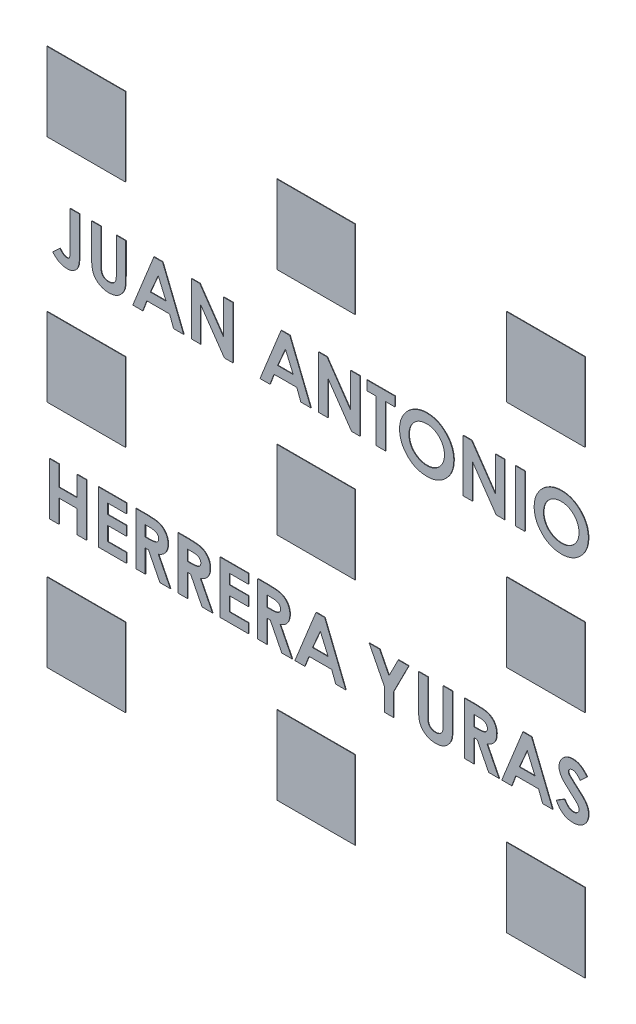
from build123d import *

# Parameters (mm, degrees)
SKETCH1_W              = 30
SKETCH1_H              = 30
BOSS_EXTRUDE1_DEPTH    = 0.2
BOSS_EXTRUDE1_2_DEPTH  = 0.2
BOSS_EXTRUDE1_3_DEPTH  = 0.2
BOSS_EXTRUDE1_4_DEPTH  = 0.2
BOSS_EXTRUDE1_5_DEPTH  = 0.2
BOSS_EXTRUDE1_6_DEPTH  = 0.2
BOSS_EXTRUDE1_7_DEPTH  = 0.2
BOSS_EXTRUDE1_8_DEPTH  = 0.2
BOSS_EXTRUDE1_9_DEPTH  = 0.2
BOSS_EXTRUDE1_10_DEPTH = 0.2
BOSS_EXTRUDE1_11_DEPTH = 0.2
BOSS_EXTRUDE1_12_DEPTH = 0.2
BOSS_EXTRUDE1_13_DEPTH = 0.2
BOSS_EXTRUDE1_14_DEPTH = 0.2
BOSS_EXTRUDE1_15_DEPTH = 0.2
BOSS_EXTRUDE1_16_DEPTH = 0.2
BOSS_EXTRUDE1_17_DEPTH = 0.2
BOSS_EXTRUDE1_18_DEPTH = 0.2
SKETCH1_W_2            = 3.589743589
SKETCH1_H_2            = 20
BOSS_EXTRUDE1_19_DEPTH = 0.2
BOSS_EXTRUDE1_20_DEPTH = 0.2
BOSS_EXTRUDE1_21_DEPTH = 0.2
BOSS_EXTRUDE1_22_DEPTH = 0.2
BOSS_EXTRUDE1_23_DEPTH = 0.2
BOSS_EXTRUDE1_24_DEPTH = 0.2
BOSS_EXTRUDE1_25_DEPTH = 0.2
BOSS_EXTRUDE1_26_DEPTH = 0.2
BOSS_EXTRUDE1_27_DEPTH = 0.2
BOSS_EXTRUDE1_28_DEPTH = 0.2
BOSS_EXTRUDE1_29_DEPTH = 0.2
BOSS_EXTRUDE1_30_DEPTH = 0.2
BOSS_EXTRUDE1_31_DEPTH = 0.2
BOSS_EXTRUDE1_32_DEPTH = 0.2


with BuildPart() as part:
    # Sketch1 → Boss-Extrude1 (new body)
    with BuildSketch(Plane.XY):
        with Locations((-88, -88)):
            Rectangle(SKETCH1_W, SKETCH1_H)
    extrude(amount=BOSS_EXTRUDE1_DEPTH)


with BuildPart() as body_2:
    # Sketch1 → Boss-Extrude1 2 (new body)
    with BuildSketch(Plane.XY):
        with Locations((0, -88)):
            Rectangle(SKETCH1_W, SKETCH1_H)
    extrude(amount=BOSS_EXTRUDE1_2_DEPTH)


with BuildPart() as body_3:
    # Sketch1 → Boss-Extrude1 3 (new body)
    with BuildSketch(Plane.XY):
        with Locations((88, -88)):
            Rectangle(SKETCH1_W, SKETCH1_H)
    extrude(amount=BOSS_EXTRUDE1_3_DEPTH)


with BuildPart() as body_4:
    # Sketch1 → Boss-Extrude1 4 (new body)
    with BuildSketch(Plane.XY):
        Rectangle(SKETCH1_W, SKETCH1_H)
    extrude(amount=BOSS_EXTRUDE1_4_DEPTH)


with BuildPart() as body_5:
    # Sketch1 → Boss-Extrude1 5 (new body)
    with BuildSketch(Plane.XY):
        with Locations((88, 0)):
            Rectangle(SKETCH1_W, SKETCH1_H)
    extrude(amount=BOSS_EXTRUDE1_5_DEPTH)


with BuildPart() as body_6:
    # Sketch1 → Boss-Extrude1 6 (new body)
    with BuildSketch(Plane.XY):
        with Locations((0, 88)):
            Rectangle(SKETCH1_W, SKETCH1_H)
    extrude(amount=BOSS_EXTRUDE1_6_DEPTH)


with BuildPart() as body_7:
    # Sketch1 → Boss-Extrude1 7 (new body)
    with BuildSketch(Plane.XY):
        with Locations((88, 88)):
            Rectangle(SKETCH1_W, SKETCH1_H)
    extrude(amount=BOSS_EXTRUDE1_7_DEPTH)


with BuildPart() as body_8:
    # Sketch1 → Boss-Extrude1 8 (new body)
    with BuildSketch(Plane.XY):
        with Locations((-88, 0)):
            Rectangle(SKETCH1_W, SKETCH1_H)
    extrude(amount=BOSS_EXTRUDE1_8_DEPTH)


with BuildPart() as body_9:
    # Sketch1 → Boss-Extrude1 9 (new body)
    with BuildSketch(Plane.XY):
        with Locations((-88, 88)):
            Rectangle(SKETCH1_W, SKETCH1_H)
    extrude(amount=BOSS_EXTRUDE1_9_DEPTH)


with BuildPart() as body_10:
    # Sketch1 → Boss-Extrude1 10 (new body)
    with BuildSketch(Plane.XY):
        with BuildLine():
            Line((-94.130265897, 53.597343664), (-90.540522307, 53.597343664))
            Line((-90.540522307, 53.597343664), (-90.540522307, 40.320100074))
            add(Edge.make_bspline(
                [(-90.540522307, 40.320100074), (-90.541838415, 40.066336043), (-90.544374295, 39.577382858), (-90.56976295, 38.873470764), (-90.604092888, 38.228088426), (-90.653531311, 37.642269956), (-90.726960905, 37.116043681), (-90.810060909, 36.648096716), (-90.901743281, 36.236522307), (-91.056617304, 35.775906513), (-91.297054737, 35.265826918), (-91.659881687, 34.714868468), (-92.111717373, 34.236179458), (-92.632082835, 33.820382724), (-93.225362538, 33.491150364), (-93.877888712, 33.253180333), (-94.587575385, 33.111015388), (-95.079122647, 33.093526872), (-95.332188974, 33.084523151)],
                knots=[0, 0, 0, 0, 1.22248561, 2.355488409, 3.392943897, 4.335991845, 5.186735882, 5.951517034, 6.625683685, 7.215700098, 8.28923535, 9.333114649, 10.380102123, 11.447198135, 12.530158036, 13.633358744, 14.781567393, 16, 16, 16, 16], degree=3))
            add(Edge.make_bspline(
                [(-95.332188974, 33.084523151), (-95.595861059, 33.092686135), (-96.115925373, 33.108786728), (-96.878653251, 33.245922433), (-97.611730086, 33.465792231), (-98.311363327, 33.78369757), (-98.98713816, 34.18191696), (-99.626789892, 34.675869353), (-100.243673572, 35.250235119), (-100.609365983, 35.690988993), (-100.796932564, 35.917055202)],
                knots=[0, 0, 0, 0, 0.990984786, 1.954608977, 2.90473533, 3.862451285, 4.837525908, 5.848096122, 6.896271184, 8, 8, 8, 8], degree=3))
            Line((-100.796932564, 35.917055202), (-98.08058641, 38.429074433))
            add(Edge.make_bspline(
                [(-98.08058641, 38.429074433), (-97.938361591, 38.268258328), (-97.67222072, 37.967328161), (-97.271154272, 37.574907834), (-96.909370726, 37.259643395), (-96.568328594, 37.032240316), (-96.246495315, 36.871946531), (-95.936946421, 36.756482412), (-95.630032828, 36.691123163), (-95.42727635, 36.6798005), (-95.328182564, 36.67426674)],
                knots=[0, 0, 0, 0, 1.529509877, 2.862124173, 3.996688592, 4.944357383, 5.774364335, 6.554177287, 7.293378699, 8, 8, 8, 8], degree=3))
            add(Edge.make_bspline(
                [(-95.328182564, 36.67426674), (-95.232270809, 36.679268384), (-95.047864036, 36.6888849), (-94.79429765, 36.795784668), (-94.58052487, 36.963621797), (-94.439789489, 37.156572356), (-94.350103805, 37.353819773), (-94.2940665, 37.544489724), (-94.240887, 37.773051318), (-94.19828077, 38.039390001), (-94.166087427, 38.346979799), (-94.150041373, 38.692086587), (-94.130527312, 39.07657527), (-94.130356134, 39.345173983), (-94.130265897, 39.48676674)],
                knots=[0, 0, 0, 0, 1.003927327, 1.930222208, 2.840933547, 3.835773585, 4.407906147, 5.114514582, 5.922289074, 6.876303333, 7.950072246, 9.174518422, 10.510537432, 12, 12, 12, 12], degree=3))
            Line((-94.130265897, 39.48676674), (-94.130265897, 53.597343664))
        make_face()
    extrude(amount=BOSS_EXTRUDE1_10_DEPTH)


with BuildPart() as body_11:
    # Sketch1 → Boss-Extrude1 11 (new body)
    with BuildSketch(Plane.XY):
        with BuildLine():
            Line((-85.925137692, 53.597343664), (-82.335394102, 53.597343664))
            Line((-82.335394102, 53.597343664), (-82.335394102, 40.584523151))
            add(Edge.make_bspline(
                [(-82.335394102, 40.584523151), (-82.33519891, 40.449611872), (-82.334821897, 40.18903213), (-82.31594846, 39.815185516), (-82.298677964, 39.471542202), (-82.267517086, 39.158478405), (-82.22148179, 38.875860207), (-82.176904601, 38.621872169), (-82.116573784, 38.40106166), (-82.025906212, 38.14972149), (-81.886217247, 37.867327082), (-81.657973228, 37.573009151), (-81.394599156, 37.304401321), (-81.078930162, 37.08082234), (-80.724146128, 36.899967096), (-80.332196437, 36.765973376), (-79.903633597, 36.691490658), (-79.607305902, 36.680119507), (-79.454785128, 36.67426674)],
                knots=[0, 0, 0, 0, 1.155499968, 2.231836252, 3.205919964, 4.102923608, 4.924856345, 5.658536265, 6.31071849, 6.882491295, 7.94666036, 8.992281882, 10.060072772, 11.158554251, 12.289267114, 13.461410017, 14.693379945, 16, 16, 16, 16], degree=3))
            add(Edge.make_bspline(
                [(-79.454785128, 36.67426674), (-79.292750628, 36.678995024), (-78.976810785, 36.688214378), (-78.522381617, 36.778712309), (-78.101350417, 36.922816009), (-77.722631849, 37.128488714), (-77.386602801, 37.375023497), (-77.102161252, 37.656150405), (-76.877681027, 37.972430148), (-76.731373168, 38.264222295), (-76.64922851, 38.532791557), (-76.587656997, 38.772748001), (-76.542518267, 39.055872853), (-76.501566927, 39.377744508), (-76.476958326, 39.741696935), (-76.450274311, 40.144803183), (-76.440494371, 40.589821413), (-76.438827452, 40.899695958), (-76.437958205, 41.061285971)],
                knots=[0, 0, 0, 0, 1.261321664, 2.459363699, 3.594844139, 4.716940403, 5.803436589, 6.833651888, 7.818396249, 8.814403945, 9.360733334, 10.004355033, 10.743453831, 11.592799886, 12.532235708, 13.585170094, 14.740740724, 16, 16, 16, 16], degree=3))
            Line((-76.437958205, 41.061285971), (-76.437958205, 53.597343664))
            Line((-76.437958205, 53.597343664), (-72.848214615, 53.597343664))
            Line((-72.848214615, 53.597343664), (-72.848214615, 41.66625392))
            add(Edge.make_bspline(
                [(-72.848214615, 41.66625392), (-72.848713116, 41.424530612), (-72.849671685, 40.959720265), (-72.864392417, 40.291755087), (-72.895730191, 39.681676043), (-72.922050306, 39.12930487), (-72.972988743, 38.635385703), (-73.026054645, 38.197809367), (-73.093691702, 37.818126532), (-73.194331576, 37.385903765), (-73.368006204, 36.888215079), (-73.647992474, 36.315148132), (-74.003416922, 35.754080878), (-74.423510856, 35.211185444), (-74.897835336, 34.706853082), (-75.415873571, 34.264114548), (-75.969395222, 33.88960549), (-76.564184194, 33.592483107), (-77.199734291, 33.360750046), (-77.882333805, 33.205037102), (-78.61151726, 33.099835482), (-79.115178054, 33.089729572), (-79.374656923, 33.084523151)],
                knots=[0, 0, 0, 0, 1.170808336, 2.251350247, 3.235597562, 4.129743112, 4.929140599, 5.639994148, 6.264258765, 6.79612947, 7.788252245, 8.809469599, 9.879094798, 10.999557536, 12.129761673, 13.226370002, 14.293821979, 15.358369427, 16.438775801, 17.562147481, 18.744053101, 20, 20, 20, 20], degree=3))
            add(Edge.make_bspline(
                [(-79.374656923, 33.084523151), (-79.547059845, 33.08742705), (-79.887207274, 33.093156384), (-80.38745374, 33.143674146), (-80.871040217, 33.218118332), (-81.33705805, 33.326724733), (-81.787124698, 33.467023918), (-82.221120591, 33.639722444), (-82.637432894, 33.84385702), (-83.033731981, 34.077550051), (-83.409530174, 34.330248834), (-83.752990324, 34.610376073), (-84.075931702, 34.8972153), (-84.369024664, 35.202837927), (-84.634470601, 35.524035439), (-84.871722827, 35.861535774), (-85.080428862, 36.215308954), (-85.265838594, 36.591731719), (-85.424531229, 37.00993628), (-85.558315082, 37.484798346), (-85.675191804, 38.023760904), (-85.762047687, 38.62803821), (-85.840791741, 39.295638632), (-85.890632386, 40.028301372), (-85.91670627, 40.82604745), (-85.922256203, 41.379108268), (-85.925137692, 41.66625392)],
                knots=[0, 0, 0, 0, 1.001158378, 1.975264943, 2.917723546, 3.841610987, 4.75185031, 5.653588123, 6.552117133, 7.442167995, 8.324307438, 9.179605724, 10.014504199, 10.831958861, 11.636465792, 12.43274043, 13.225645099, 14.020104002, 14.867201867, 15.819789774, 16.883317127, 18.068162734, 19.364263498, 20.787406516, 22.332041935, 24, 24, 24, 24], degree=3))
            Line((-85.925137692, 41.66625392), (-85.925137692, 53.597343664))
        make_face()
    extrude(amount=BOSS_EXTRUDE1_11_DEPTH)


with BuildPart() as body_12:
    # Sketch1 → Boss-Extrude1 12 (new body)
    with BuildSketch(Plane.XY):
        Polygon((-62.074977436, 53.597343664), (-58.745650513, 53.597343664), (-50.668727436, 33.597343664), (-54.502862051, 33.597343664), (-56.057349231, 37.699907766), (-64.771291538, 37.699907766), (-66.325778718, 33.597343664), (-70.155906923, 33.597343664), align=None)
        Polygon((-60.412317179, 48.23276033), (-63.409112051, 41.289651356), (-57.415522307, 41.289651356), align=None, mode=Mode.SUBTRACT)
    extrude(amount=BOSS_EXTRUDE1_12_DEPTH)


with BuildPart() as body_13:
    # Sketch1 → Boss-Extrude1 13 (new body)
    with BuildSketch(Plane.XY):
        Polygon((-47.720009487, 53.597343664), (-44.48683641, 53.597343664), (-35.412317179, 40.436285971), (-35.412317179, 53.597343664), (-31.822573589, 53.597343664), (-31.822573589, 33.597343664), (-35.079785128, 33.597343664), (-44.130265897, 46.718337253), (-44.130265897, 33.597343664), (-47.720009487, 33.597343664), align=None)
    extrude(amount=BOSS_EXTRUDE1_13_DEPTH)


with BuildPart() as body_14:
    # Sketch1 → Boss-Extrude1 14 (new body)
    with BuildSketch(Plane.XY):
        Polygon((-13.357028718, 53.597343664), (-10.027701795, 53.597343664), (-1.950778718, 33.597343664), (-5.784913333, 33.597343664), (-7.339400513, 37.699907766), (-16.05334282, 37.699907766), (-17.60783, 33.597343664), (-21.437958205, 33.597343664), align=None)
        Polygon((-11.694368461, 48.23276033), (-14.691163333, 41.289651356), (-8.697573589, 41.289651356), align=None, mode=Mode.SUBTRACT)
    extrude(amount=BOSS_EXTRUDE1_14_DEPTH)


with BuildPart() as body_15:
    # Sketch1 → Boss-Extrude1 15 (new body)
    with BuildSketch(Plane.XY):
        Polygon((0.997939231, 53.597343664), (4.231112308, 53.597343664), (13.305631539, 40.436285971), (13.305631539, 53.597343664), (16.895375128, 53.597343664), (16.895375128, 33.597343664), (13.63816359, 33.597343664), (4.587682821, 46.718337253), (4.587682821, 33.597343664), (0.997939231, 33.597343664), align=None)
    extrude(amount=BOSS_EXTRUDE1_15_DEPTH)


with BuildPart() as body_16:
    # Sketch1 → Boss-Extrude1 16 (new body)
    with BuildSketch(Plane.XY):
        Polygon((19.459477693, 53.597343664), (30.228708462, 53.597343664), (30.228708462, 50.007600074), (26.638964872, 50.007600074), (26.638964872, 33.597343664), (23.049221282, 33.597343664), (23.049221282, 50.007600074), (19.459477693, 50.007600074), align=None)
    extrude(amount=BOSS_EXTRUDE1_16_DEPTH)


with BuildPart() as body_17:
    # Sketch1 → Boss-Extrude1 17 (new body)
    with BuildSketch(Plane.XY):
        with BuildLine():
            add(Edge.make_bspline(
                [(42.448259744, 54.110164176), (42.795984255, 54.101160966), (43.482471198, 54.08338659), (44.492045765, 53.935223291), (45.464957529, 53.693812437), (46.400766543, 53.358233888), (47.297129649, 52.919398473), (48.15720862, 52.389747463), (48.977922693, 51.759284013), (49.75086185, 51.042715795), (50.465197033, 50.263479147), (51.084168886, 49.424492357), (51.612005375, 48.547494417), (52.049477669, 47.630135385), (52.382694248, 46.666062113), (52.616526104, 45.660190099), (52.766751487, 44.612805505), (52.784029717, 43.899679357), (52.792811026, 43.53724751)],
                knots=[0, 0, 0, 0, 1.014329547, 2.002516266, 2.970391464, 3.935626869, 4.897733899, 5.877609409, 6.878433252, 7.912639331, 8.949961323, 9.958554974, 10.949718813, 11.932905612, 12.9188844, 13.919928257, 14.942845884, 16, 16, 16, 16], degree=3))
            add(Edge.make_bspline(
                [(52.792811026, 43.53724751), (52.783459312, 43.178899433), (52.76503146, 42.47276305), (52.622658962, 41.435030517), (52.384889348, 40.439933488), (52.057324383, 39.485219538), (51.627786183, 38.575512974), (51.11024308, 37.705005445), (50.491038097, 36.88177547), (49.792756071, 36.106264826), (49.02400816, 35.402322511), (48.209782085, 34.78197456), (47.353837439, 34.256315118), (46.457427052, 33.82558496), (45.518628614, 33.491311147), (44.539761074, 33.255456683), (43.520885002, 33.112123163), (42.827999863, 33.093815679), (42.476304616, 33.084523151)],
                knots=[0, 0, 0, 0, 1.051557043, 2.072126891, 3.067553643, 4.050577992, 5.02905126, 6.015227836, 7.017913613, 8.04756643, 9.074058332, 10.072836633, 11.047628519, 12.017157415, 12.98668631, 13.966869689, 14.968021931, 16, 16, 16, 16], degree=3))
            add(Edge.make_bspline(
                [(42.476304616, 33.084523151), (42.108473557, 33.092859007), (41.385735805, 33.109237825), (40.328005869, 33.264992906), (39.314609195, 33.499614469), (38.354058898, 33.849774565), (37.436572594, 34.287504128), (36.568891326, 34.826594329), (35.751306691, 35.466154279), (34.988508487, 36.189804611), (34.297411468, 36.981636795), (33.687382789, 37.818137278), (33.172810065, 38.692915932), (32.753674471, 39.606382173), (32.423244805, 40.55285903), (32.19016422, 41.538110819), (32.052477956, 42.559774551), (32.033299059, 43.253708981), (32.023580257, 43.605356484)],
                knots=[0, 0, 0, 0, 1.067978421, 2.098431617, 3.099715153, 4.085208694, 5.062210972, 6.048429807, 7.046490867, 8.072918869, 9.098532598, 10.095778865, 11.076610158, 12.041847152, 13.011192615, 13.984257998, 14.978533688, 16, 16, 16, 16], degree=3))
            add(Edge.make_bspline(
                [(32.023580257, 43.605356484), (32.026630577, 43.841926516), (32.032692592, 44.312071059), (32.105715959, 45.008801274), (32.210848611, 45.691932251), (32.366334815, 46.358740337), (32.555210813, 47.013929551), (32.799926349, 47.651401232), (33.078478854, 48.27796533), (33.40394123, 48.886221337), (33.765823923, 49.470572791), (34.16067016, 50.028263204), (34.589472777, 50.552549283), (35.050850459, 51.046876421), (35.546393175, 51.507995368), (36.069582573, 51.942433907), (36.630565481, 52.338651805), (37.217063744, 52.706325493), (37.825770818, 53.038806432), (38.454208715, 53.321804265), (39.089430371, 53.568941451), (39.739921492, 53.763993046), (40.398710907, 53.92286053), (41.072836449, 54.027922323), (41.756207774, 54.100943667), (42.217028295, 54.107083379), (42.448259744, 54.110164176)],
                knots=[0, 0, 0, 0, 1.034744296, 2.056386356, 3.06226378, 4.057406941, 5.050368692, 6.043467995, 7.042652155, 8.049140477, 9.059438543, 10.048523776, 11.036952808, 12.020949711, 13.004946614, 13.997082645, 14.994316842, 16.007702937, 17.024872941, 18.026463647, 19.021641123, 20.005082605, 20.995858141, 21.984425357, 22.988620895, 24, 24, 24, 24], degree=3))
        make_face()
        with BuildLine():
            add(Edge.make_bspline(
                [(42.39217, 50.520420587), (42.15815145, 50.514141343), (41.696292478, 50.50174863), (41.018829478, 50.407332917), (40.368441073, 50.256540291), (39.748732624, 50.038119016), (39.15701826, 49.760124167), (38.592249054, 49.423527094), (38.062245894, 49.016757647), (37.559941698, 48.561653466), (37.106192512, 48.054562818), (36.705290793, 47.51112895), (36.369800626, 46.932259386), (36.088825509, 46.323331687), (35.877313519, 45.677498624), (35.72665987, 44.999819076), (35.631452388, 44.289125368), (35.619451366, 43.804646392), (35.613323846, 43.557279561)],
                knots=[0, 0, 0, 0, 1.033739768, 2.040188636, 3.016340934, 3.979330865, 4.937572243, 5.900995986, 6.878200029, 7.884839167, 8.891893314, 9.879764717, 10.863503415, 11.843163062, 12.837761627, 13.859916423, 14.907309254, 16, 16, 16, 16], degree=3))
            add(Edge.make_bspline(
                [(35.613323846, 43.557279561), (35.621448003, 43.283141467), (35.637370002, 42.745876227), (35.74939913, 41.962128168), (35.941069816, 41.221955915), (36.21783856, 40.528979537), (36.561104413, 39.875504051), (36.987386124, 39.269538729), (37.489779945, 38.707455333), (37.876820075, 38.379287633), (38.073259744, 38.212728279)],
                knots=[0, 0, 0, 0, 1.078454662, 2.113592447, 3.107694534, 4.079536787, 5.043276885, 6.005368276, 6.987637804, 8, 8, 8, 8], degree=3))
            add(Edge.make_bspline(
                [(38.073259744, 38.212728279), (38.234181335, 38.089680625), (38.552398928, 37.846357601), (39.060343487, 37.53448923), (39.583426363, 37.267186926), (40.125594874, 37.051209826), (40.685703986, 36.881325869), (41.263676893, 36.762358928), (41.858694654, 36.687696884), (42.26107355, 36.678773355), (42.464285385, 36.67426674)],
                knots=[0, 0, 0, 0, 1.023928204, 2.024787132, 3.009472467, 3.9914905, 4.972207045, 5.96565515, 6.972602802, 8, 8, 8, 8], degree=3))
            add(Edge.make_bspline(
                [(42.464285385, 36.67426674), (42.69427998, 36.680599225), (43.14680158, 36.693058586), (43.811653241, 36.78631199), (44.448601325, 36.944130419), (45.06160006, 37.160635626), (45.648881831, 37.44212094), (46.207576433, 37.789158199), (46.73866341, 38.197486232), (47.240327676, 38.658566928), (47.69887253, 39.167655162), (48.098937651, 39.713987651), (48.445094729, 40.285527054), (48.720226964, 40.890362646), (48.940095315, 41.522785061), (49.088935768, 42.185595163), (49.184947538, 42.876060595), (49.196951941, 43.345946723), (49.203067436, 43.585324433)],
                knots=[0, 0, 0, 0, 1.026359118, 2.019393844, 2.989460624, 3.950973911, 4.916101784, 5.890408035, 6.881132271, 7.902007068, 8.92769091, 9.933912415, 10.920395702, 11.90457117, 12.894218921, 13.903490204, 14.931958862, 16, 16, 16, 16], degree=3))
            add(Edge.make_bspline(
                [(49.203067436, 43.585324433), (49.196740344, 43.823325655), (49.184286427, 44.291794764), (49.090868892, 44.980485014), (48.934051307, 45.640369004), (48.716895957, 46.272524391), (48.439600075, 46.877570925), (48.096695587, 47.453380902), (47.6893857, 47.999397657), (47.227044627, 48.511900292), (46.723814786, 48.982857386), (46.183547269, 49.391562532), (45.621359369, 49.746714309), (45.02435175, 50.024925871), (44.404738691, 50.246576431), (43.758739278, 50.409803085), (43.083906751, 50.501085355), (42.624804228, 50.51391806), (42.39217, 50.520420587)],
                knots=[0, 0, 0, 0, 1.055025985, 2.07665775, 3.074803781, 4.057872707, 5.035505728, 6.020516407, 7.023567878, 8.050795229, 9.077271434, 10.074415901, 11.050397877, 12.019801805, 12.988065821, 13.964604439, 14.968634123, 16, 16, 16, 16], degree=3))
        make_face(mode=Mode.SUBTRACT)
    extrude(amount=BOSS_EXTRUDE1_17_DEPTH)


with BuildPart() as body_18:
    # Sketch1 → Boss-Extrude1 18 (new body)
    with BuildSketch(Plane.XY):
        Polygon((56.382554616, 53.597343664), (59.615727693, 53.597343664), (68.690246923, 40.436285971), (68.690246923, 53.597343664), (72.279990513, 53.597343664), (72.279990513, 33.597343664), (69.022778975, 33.597343664), (59.972298205, 46.718337253), (59.972298205, 33.597343664), (56.382554616, 33.597343664), align=None)
    extrude(amount=BOSS_EXTRUDE1_18_DEPTH)


with BuildPart() as body_19:
    # Sketch1 → Boss-Extrude1 19 (new body)
    with BuildSketch(Plane.XY):
        with Locations((78.177426411, 43.597343664)):
            Rectangle(SKETCH1_W_2, SKETCH1_H_2)
    extrude(amount=BOSS_EXTRUDE1_19_DEPTH)


with BuildPart() as body_20:
    # Sketch1 → Boss-Extrude1 20 (new body)
    with BuildSketch(Plane.XY):
        with BuildLine():
            add(Edge.make_bspline(
                [(93.986721282, 54.110164176), (94.334445794, 54.101160966), (95.020932737, 54.08338659), (96.030507303, 53.935223291), (97.003419067, 53.693812437), (97.939228081, 53.358233888), (98.835591188, 52.919398473), (99.695670158, 52.389747463), (100.516384232, 51.759284013), (101.289323388, 51.042715795), (102.003658571, 50.263479147), (102.622630424, 49.424492357), (103.150466913, 48.547494417), (103.587939207, 47.630135385), (103.921155786, 46.666062113), (104.154987642, 45.660190099), (104.305213025, 44.612805505), (104.322491256, 43.899679357), (104.331272564, 43.53724751)],
                knots=[0, 0, 0, 0, 1.014329547, 2.002516266, 2.970391464, 3.935626869, 4.897733899, 5.877609409, 6.878433252, 7.912639331, 8.949961323, 9.958554974, 10.949718813, 11.932905612, 12.9188844, 13.919928257, 14.942845884, 16, 16, 16, 16], degree=3))
            add(Edge.make_bspline(
                [(104.331272564, 43.53724751), (104.32192085, 43.178899433), (104.303492998, 42.47276305), (104.1611205, 41.435030517), (103.923350886, 40.439933488), (103.595785922, 39.485219538), (103.166247721, 38.575512974), (102.648704619, 37.705005445), (102.029499636, 36.88177547), (101.33121761, 36.106264826), (100.562469699, 35.402322511), (99.748243623, 34.78197456), (98.892298977, 34.256315118), (97.99588859, 33.82558496), (97.057090153, 33.491311147), (96.078222612, 33.255456683), (95.059346541, 33.112123163), (94.366461401, 33.093815679), (94.014766154, 33.084523151)],
                knots=[0, 0, 0, 0, 1.051557043, 2.072126891, 3.067553643, 4.050577992, 5.02905126, 6.015227836, 7.017913613, 8.04756643, 9.074058332, 10.072836633, 11.047628519, 12.017157415, 12.98668631, 13.966869689, 14.968021931, 16, 16, 16, 16], degree=3))
            add(Edge.make_bspline(
                [(94.014766154, 33.084523151), (93.646935095, 33.092859007), (92.924197343, 33.109237825), (91.866467407, 33.264992906), (90.853070733, 33.499614469), (89.892520436, 33.849774565), (88.975034133, 34.287504128), (88.107352865, 34.826594329), (87.289768229, 35.466154279), (86.526970026, 36.189804611), (85.835873006, 36.981636795), (85.225844327, 37.818137278), (84.711271604, 38.692915932), (84.292136009, 39.606382173), (83.961706344, 40.55285903), (83.728625758, 41.538110819), (83.590939494, 42.559774551), (83.571760597, 43.253708981), (83.562041795, 43.605356484)],
                knots=[0, 0, 0, 0, 1.067978421, 2.098431617, 3.099715153, 4.085208694, 5.062210972, 6.048429807, 7.046490867, 8.072918869, 9.098532598, 10.095778865, 11.076610158, 12.041847152, 13.011192615, 13.984257998, 14.978533688, 16, 16, 16, 16], degree=3))
            add(Edge.make_bspline(
                [(83.562041795, 43.605356484), (83.565092115, 43.841926516), (83.571154131, 44.312071059), (83.644177497, 45.008801274), (83.749310149, 45.691932251), (83.904796354, 46.358740337), (84.093672352, 47.013929551), (84.338387887, 47.651401232), (84.616940393, 48.27796533), (84.942402769, 48.886221337), (85.304285461, 49.470572791), (85.699131698, 50.028263204), (86.127934315, 50.552549283), (86.589311997, 51.046876421), (87.084854713, 51.507995368), (87.608044111, 51.942433907), (88.16902702, 52.338651805), (88.755525282, 52.706325493), (89.364232357, 53.038806432), (89.992670253, 53.321804265), (90.627891909, 53.568941451), (91.27838303, 53.763993046), (91.937172446, 53.92286053), (92.611297987, 54.027922323), (93.294669313, 54.100943667), (93.755489833, 54.107083379), (93.986721282, 54.110164176)],
                knots=[0, 0, 0, 0, 1.034744296, 2.056386356, 3.06226378, 4.057406941, 5.050368692, 6.043467995, 7.042652155, 8.049140477, 9.059438543, 10.048523776, 11.036952808, 12.020949711, 13.004946614, 13.997082645, 14.994316842, 16.007702937, 17.024872941, 18.026463647, 19.021641123, 20.005082605, 20.995858141, 21.984425357, 22.988620895, 24, 24, 24, 24], degree=3))
        make_face()
        with BuildLine():
            add(Edge.make_bspline(
                [(93.930631539, 50.520420587), (93.696612989, 50.514141343), (93.234754017, 50.50174863), (92.557291017, 50.407332917), (91.906902612, 50.256540291), (91.287194162, 50.038119016), (90.695479798, 49.760124167), (90.130710593, 49.423527094), (89.600707432, 49.016757647), (89.098403236, 48.561653466), (88.644654051, 48.054562818), (88.243752331, 47.51112895), (87.908262164, 46.932259386), (87.627287048, 46.323331687), (87.415775058, 45.677498624), (87.265121409, 44.999819076), (87.169913926, 44.289125368), (87.157912905, 43.804646392), (87.151785385, 43.557279561)],
                knots=[0, 0, 0, 0, 1.033739768, 2.040188636, 3.016340934, 3.979330865, 4.937572243, 5.900995986, 6.878200029, 7.884839167, 8.891893314, 9.879764717, 10.863503415, 11.843163062, 12.837761627, 13.859916423, 14.907309254, 16, 16, 16, 16], degree=3))
            add(Edge.make_bspline(
                [(87.151785385, 43.557279561), (87.159909541, 43.283141467), (87.175831541, 42.745876227), (87.287860669, 41.962128168), (87.479531355, 41.221955915), (87.756300098, 40.528979537), (88.099565952, 39.875504051), (88.525847662, 39.269538729), (89.028241484, 38.707455333), (89.415281613, 38.379287633), (89.611721282, 38.212728279)],
                knots=[0, 0, 0, 0, 1.078454662, 2.113592447, 3.107694534, 4.079536787, 5.043276885, 6.005368276, 6.987637804, 8, 8, 8, 8], degree=3))
            add(Edge.make_bspline(
                [(89.611721282, 38.212728279), (89.772642874, 38.089680625), (90.090860466, 37.846357601), (90.598805025, 37.53448923), (91.121887902, 37.267186926), (91.664056412, 37.051209826), (92.224165525, 36.881325869), (92.802138431, 36.762358928), (93.397156193, 36.687696884), (93.799535088, 36.678773355), (94.002746923, 36.67426674)],
                knots=[0, 0, 0, 0, 1.023928204, 2.024787132, 3.009472467, 3.9914905, 4.972207045, 5.96565515, 6.972602802, 8, 8, 8, 8], degree=3))
            add(Edge.make_bspline(
                [(94.002746923, 36.67426674), (94.232741519, 36.680599225), (94.685263119, 36.693058586), (95.350114779, 36.78631199), (95.987062863, 36.944130419), (96.600061598, 37.160635626), (97.18734337, 37.44212094), (97.746037972, 37.789158199), (98.277124948, 38.197486232), (98.778789215, 38.658566928), (99.237334069, 39.167655162), (99.63739919, 39.713987651), (99.983556268, 40.285527054), (100.258688502, 40.890362646), (100.478556853, 41.522785061), (100.627397307, 42.185595163), (100.723409077, 42.876060595), (100.735413479, 43.345946723), (100.741528975, 43.585324433)],
                knots=[0, 0, 0, 0, 1.026359118, 2.019393844, 2.989460624, 3.950973911, 4.916101784, 5.890408035, 6.881132271, 7.902007068, 8.92769091, 9.933912415, 10.920395702, 11.90457117, 12.894218921, 13.903490204, 14.931958862, 16, 16, 16, 16], degree=3))
            add(Edge.make_bspline(
                [(100.741528975, 43.585324433), (100.735201882, 43.823325655), (100.722747966, 44.291794764), (100.62933043, 44.980485014), (100.472512845, 45.640369004), (100.255357496, 46.272524391), (99.978061614, 46.877570925), (99.635157125, 47.453380902), (99.227847238, 47.999397657), (98.765506166, 48.511900292), (98.262276325, 48.982857386), (97.722008808, 49.391562532), (97.159820907, 49.746714309), (96.562813289, 50.024925871), (95.943200229, 50.246576431), (95.297200817, 50.409803085), (94.622368289, 50.501085355), (94.163265767, 50.51391806), (93.930631539, 50.520420587)],
                knots=[0, 0, 0, 0, 1.055025985, 2.07665775, 3.074803781, 4.057872707, 5.035505728, 6.020516407, 7.023567878, 8.050795229, 9.077271434, 10.074415901, 11.050397877, 12.019801805, 12.988065821, 13.964604439, 14.968634123, 16, 16, 16, 16], degree=3))
        make_face(mode=Mode.SUBTRACT)
    extrude(amount=BOSS_EXTRUDE1_20_DEPTH)


with BuildPart() as body_21:
    # Sketch1 → Boss-Extrude1 21 (new body)
    with BuildSketch(Plane.XY):
        Polygon((-102.045347458, -33.260305162), (-98.455603869, -33.260305162), (-98.455603869, -40.952612855), (-91.532526945, -40.952612855), (-91.532526945, -33.260305162), (-87.942783356, -33.260305162), (-87.942783356, -53.260305162), (-91.532526945, -53.260305162), (-91.532526945, -44.542356445), (-98.455603869, -44.542356445), (-98.455603869, -53.260305162), (-102.045347458, -53.260305162), align=None)
    extrude(amount=BOSS_EXTRUDE1_21_DEPTH)


with BuildPart() as body_22:
    # Sketch1 → Boss-Extrude1 22 (new body)
    with BuildSketch(Plane.XY):
        Polygon((-83.32739874, -33.260305162), (-72.558167971, -33.260305162), (-72.558167971, -36.850048752), (-79.737655151, -36.850048752), (-79.737655151, -40.696202598), (-72.558167971, -40.696202598), (-72.558167971, -44.285946188), (-79.737655151, -44.285946188), (-79.737655151, -49.670561573), (-72.558167971, -49.670561573), (-72.558167971, -53.260305162), (-83.32739874, -53.260305162), align=None)
    extrude(amount=BOSS_EXTRUDE1_22_DEPTH)


with BuildPart() as body_23:
    # Sketch1 → Boss-Extrude1 23 (new body)
    with BuildSketch(Plane.XY):
        with BuildLine():
            Line((-68.968424381, -33.260305162), (-64.785732074, -33.260305162))
            add(Edge.make_bspline(
                [(-64.785732074, -33.260305162), (-64.509257385, -33.261286489), (-63.977518681, -33.263173856), (-63.210780512, -33.292951512), (-62.50642606, -33.334389563), (-61.863412465, -33.39762513), (-61.282014818, -33.481467848), (-60.761650424, -33.580304538), (-60.302334491, -33.692950136), (-59.900193324, -33.833315439), (-59.537280807, -33.991645372), (-59.198995886, -34.173569369), (-58.877875493, -34.377061648), (-58.576065972, -34.607476642), (-58.290944527, -34.860669242), (-58.021973258, -35.136894311), (-57.772952979, -35.438494123), (-57.545425635, -35.763562951), (-57.338052775, -36.105527904), (-57.15477866, -36.464858502), (-57.005739846, -36.841804636), (-56.874048077, -37.230918618), (-56.779194761, -37.63776291), (-56.713225668, -38.058376813), (-56.664925679, -38.494240934), (-56.662148661, -38.790347665), (-56.660732074, -38.941394906)],
                knots=[0, 0, 0, 0, 1.749336639, 3.364467119, 4.854658419, 6.213483162, 7.451590619, 8.570285859, 9.5643256, 10.440900261, 11.26203566, 12.067320669, 12.869050712, 13.665104639, 14.467235401, 15.27997916, 16.102287765, 16.939272006, 17.78853747, 18.631303466, 19.488103222, 20.351255419, 21.228522269, 22.127379805, 23.044756219, 24, 24, 24, 24], degree=3))
            add(Edge.make_bspline(
                [(-56.660732074, -38.941394906), (-56.664411858, -39.099053527), (-56.671627243, -39.408193347), (-56.710493235, -39.862294529), (-56.781528058, -40.296746778), (-56.889120633, -40.710278069), (-57.012784323, -41.108035283), (-57.177225308, -41.48267955), (-57.362813213, -41.839659527), (-57.583230546, -42.173925599), (-57.8251278, -42.492902481), (-58.106449218, -42.784368988), (-58.408969494, -43.063990338), (-58.749694394, -43.314252001), (-59.113604447, -43.552075764), (-59.507930163, -43.767607429), (-59.930098039, -43.966264965), (-60.226902962, -44.077050129), (-60.378680792, -44.133702598)],
                knots=[0, 0, 0, 0, 1.099860209, 2.156625411, 3.176576793, 4.16617041, 5.135385252, 6.078461593, 7.016046972, 7.938469504, 8.868247731, 9.803980173, 10.76021508, 11.73834243, 12.748633912, 13.790971185, 14.870363756, 16, 16, 16, 16], degree=3))
            Line((-60.378680792, -44.133702598), (-55.763296176, -53.260305162))
            Line((-55.763296176, -53.260305162), (-59.753680792, -53.260305162))
            Line((-59.753680792, -53.260305162), (-64.160732074, -44.542356445))
            Line((-64.160732074, -44.542356445), (-65.378680792, -44.542356445))
            Line((-65.378680792, -44.542356445), (-65.378680792, -53.260305162))
            Line((-65.378680792, -53.260305162), (-68.968424381, -53.260305162))
            Line((-68.968424381, -53.260305162), (-68.968424381, -33.260305162))
        make_face()
        with BuildLine():
            Line((-65.378680792, -40.952612855), (-63.980443612, -40.952612855))
            add(Edge.make_bspline(
                [(-63.980443612, -40.952612855), (-63.809497494, -40.950687545), (-63.48217241, -40.94700099), (-63.011435947, -40.929901219), (-62.583894975, -40.888699221), (-62.197713487, -40.836642037), (-61.850948253, -40.7765345), (-61.546692298, -40.690396751), (-61.2802575, -40.598097971), (-61.054801124, -40.483394531), (-60.862176376, -40.352951841), (-60.695857235, -40.204765703), (-60.558287458, -40.033259117), (-60.445060515, -39.843092893), (-60.356982263, -39.632585056), (-60.292691887, -39.404046506), (-60.256763074, -39.154873895), (-60.252629341, -38.982910866), (-60.250475663, -38.893317983)],
                knots=[0, 0, 0, 0, 1.688639943, 3.233382647, 4.650958383, 5.928841754, 7.082724185, 8.122798841, 9.049171256, 9.863274652, 10.613301712, 11.341792392, 12.054588806, 12.776240173, 13.521029143, 14.301969904, 15.115324896, 16, 16, 16, 16], degree=3))
            add(Edge.make_bspline(
                [(-60.250475663, -38.893317983), (-60.254547389, -38.787323062), (-60.262545539, -38.579115682), (-60.341912039, -38.279370062), (-60.468246363, -38.001934982), (-60.641416119, -37.748063963), (-60.859500913, -37.525503103), (-61.10977042, -37.329313932), (-61.397626061, -37.174182215), (-61.664158723, -37.071858986), (-61.906641146, -37.010637943), (-62.125473882, -36.965016563), (-62.378883509, -36.932683382), (-62.667061335, -36.898388288), (-62.989272787, -36.876149655), (-63.347274109, -36.859919886), (-63.740037124, -36.85327949), (-64.013830248, -36.851156672), (-64.156725663, -36.850048752)],
                knots=[0, 0, 0, 0, 1.020303359, 2.004196876, 2.966617323, 3.9489082, 4.950758222, 5.960522915, 7.003732012, 8.091992268, 8.70421221, 9.413913587, 10.24622431, 11.166358409, 12.212345909, 13.359657661, 14.621978493, 16, 16, 16, 16], degree=3))
            Line((-64.156725663, -36.850048752), (-65.378680792, -36.850048752))
            Line((-65.378680792, -36.850048752), (-65.378680792, -40.952612855))
        make_face(mode=Mode.SUBTRACT)
    extrude(amount=BOSS_EXTRUDE1_23_DEPTH)


with BuildPart() as body_24:
    # Sketch1 → Boss-Extrude1 24 (new body)
    with BuildSketch(Plane.XY):
        with BuildLine():
            Line((-52.814578228, -33.260305162), (-48.63188592, -33.260305162))
            add(Edge.make_bspline(
                [(-48.63188592, -33.260305162), (-48.355411231, -33.261286489), (-47.823672527, -33.263173856), (-47.056934358, -33.292951512), (-46.352579906, -33.334389563), (-45.709566311, -33.39762513), (-45.128168665, -33.481467848), (-44.60780427, -33.580304538), (-44.148488337, -33.692950136), (-43.74634717, -33.833315439), (-43.383434653, -33.991645372), (-43.045149732, -34.173569369), (-42.72402934, -34.377061648), (-42.422219818, -34.607476642), (-42.137098373, -34.860669242), (-41.868127104, -35.136894311), (-41.619106826, -35.438494123), (-41.391579481, -35.763562951), (-41.184206621, -36.105527904), (-41.000932507, -36.464858502), (-40.851893692, -36.841804636), (-40.720201923, -37.230918618), (-40.625348608, -37.63776291), (-40.559379515, -38.058376813), (-40.511079525, -38.494240934), (-40.508302507, -38.790347665), (-40.50688592, -38.941394906)],
                knots=[0, 0, 0, 0, 1.749336639, 3.364467119, 4.854658419, 6.213483162, 7.451590619, 8.570285859, 9.5643256, 10.440900261, 11.26203566, 12.067320669, 12.869050712, 13.665104639, 14.467235401, 15.27997916, 16.102287765, 16.939272006, 17.78853747, 18.631303466, 19.488103222, 20.351255419, 21.228522269, 22.127379805, 23.044756219, 24, 24, 24, 24], degree=3))
            add(Edge.make_bspline(
                [(-40.50688592, -38.941394906), (-40.510565704, -39.099053527), (-40.517781089, -39.408193347), (-40.556647081, -39.862294529), (-40.627681905, -40.296746778), (-40.735274479, -40.710278069), (-40.858938169, -41.108035283), (-41.023379154, -41.48267955), (-41.208967059, -41.839659527), (-41.429384392, -42.173925599), (-41.671281646, -42.492902481), (-41.952603065, -42.784368988), (-42.25512334, -43.063990338), (-42.59584824, -43.314252001), (-42.959758293, -43.552075764), (-43.354084009, -43.767607429), (-43.776251885, -43.966264965), (-44.073056808, -44.077050129), (-44.224834638, -44.133702598)],
                knots=[0, 0, 0, 0, 1.099860209, 2.156625411, 3.176576793, 4.16617041, 5.135385252, 6.078461593, 7.016046972, 7.938469504, 8.868247731, 9.803980173, 10.76021508, 11.73834243, 12.748633912, 13.790971185, 14.870363756, 16, 16, 16, 16], degree=3))
            Line((-44.224834638, -44.133702598), (-39.609450022, -53.260305162))
            Line((-39.609450022, -53.260305162), (-43.599834638, -53.260305162))
            Line((-43.599834638, -53.260305162), (-48.00688592, -44.542356445))
            Line((-48.00688592, -44.542356445), (-49.224834638, -44.542356445))
            Line((-49.224834638, -44.542356445), (-49.224834638, -53.260305162))
            Line((-49.224834638, -53.260305162), (-52.814578228, -53.260305162))
            Line((-52.814578228, -53.260305162), (-52.814578228, -33.260305162))
        make_face()
        with BuildLine():
            Line((-49.224834638, -40.952612855), (-47.826597458, -40.952612855))
            add(Edge.make_bspline(
                [(-47.826597458, -40.952612855), (-47.65565134, -40.950687545), (-47.328326256, -40.94700099), (-46.857589793, -40.929901219), (-46.430048821, -40.888699221), (-46.043867333, -40.836642037), (-45.697102099, -40.7765345), (-45.392846144, -40.690396751), (-45.126411347, -40.598097971), (-44.90095497, -40.483394531), (-44.708330222, -40.352951841), (-44.542011081, -40.204765703), (-44.404441304, -40.033259117), (-44.291214361, -39.843092893), (-44.203136109, -39.632585056), (-44.138845733, -39.404046506), (-44.10291692, -39.154873895), (-44.098783188, -38.982910866), (-44.09662951, -38.893317983)],
                knots=[0, 0, 0, 0, 1.688639943, 3.233382647, 4.650958383, 5.928841754, 7.082724185, 8.122798841, 9.049171256, 9.863274652, 10.613301712, 11.341792392, 12.054588806, 12.776240173, 13.521029143, 14.301969904, 15.115324896, 16, 16, 16, 16], degree=3))
            add(Edge.make_bspline(
                [(-44.09662951, -38.893317983), (-44.100701235, -38.787323062), (-44.108699386, -38.579115682), (-44.188065885, -38.279370062), (-44.314400209, -38.001934982), (-44.487569965, -37.748063963), (-44.705654759, -37.525503103), (-44.955924267, -37.329313932), (-45.243779908, -37.174182215), (-45.51031257, -37.071858986), (-45.752794992, -37.010637943), (-45.971627729, -36.965016563), (-46.225037355, -36.932683382), (-46.513215181, -36.898388288), (-46.835426633, -36.876149655), (-47.193427955, -36.859919886), (-47.58619097, -36.85327949), (-47.859984095, -36.851156672), (-48.00287951, -36.850048752)],
                knots=[0, 0, 0, 0, 1.020303359, 2.004196876, 2.966617323, 3.9489082, 4.950758222, 5.960522915, 7.003732012, 8.091992268, 8.70421221, 9.413913587, 10.24622431, 11.166358409, 12.212345909, 13.359657661, 14.621978493, 16, 16, 16, 16], degree=3))
            Line((-48.00287951, -36.850048752), (-49.224834638, -36.850048752))
            Line((-49.224834638, -36.850048752), (-49.224834638, -40.952612855))
        make_face(mode=Mode.SUBTRACT)
    extrude(amount=BOSS_EXTRUDE1_24_DEPTH)


with BuildPart() as body_25:
    # Sketch1 → Boss-Extrude1 25 (new body)
    with BuildSketch(Plane.XY):
        Polygon((-36.660732074, -33.260305162), (-25.891501304, -33.260305162), (-25.891501304, -36.850048752), (-33.070988484, -36.850048752), (-33.070988484, -40.696202598), (-25.891501304, -40.696202598), (-25.891501304, -44.285946188), (-33.070988484, -44.285946188), (-33.070988484, -49.670561573), (-25.891501304, -49.670561573), (-25.891501304, -53.260305162), (-36.660732074, -53.260305162), align=None)
    extrude(amount=BOSS_EXTRUDE1_25_DEPTH)


with BuildPart() as body_26:
    # Sketch1 → Boss-Extrude1 26 (new body)
    with BuildSketch(Plane.XY):
        with BuildLine():
            Line((-22.301757715, -33.260305162), (-18.119065407, -33.260305162))
            add(Edge.make_bspline(
                [(-18.119065407, -33.260305162), (-17.842590719, -33.261286489), (-17.310852014, -33.263173856), (-16.544113845, -33.292951512), (-15.839759394, -33.334389563), (-15.196745798, -33.39762513), (-14.615348152, -33.481467848), (-14.094983757, -33.580304538), (-13.635667824, -33.692950136), (-13.233526657, -33.833315439), (-12.87061414, -33.991645372), (-12.532329219, -34.173569369), (-12.211208827, -34.377061648), (-11.909399306, -34.607476642), (-11.62427786, -34.860669242), (-11.355306591, -35.136894311), (-11.106286313, -35.438494123), (-10.878758968, -35.763562951), (-10.671386108, -36.105527904), (-10.488111994, -36.464858502), (-10.339073179, -36.841804636), (-10.20738141, -37.230918618), (-10.112528095, -37.63776291), (-10.046559002, -38.058376813), (-9.998259013, -38.494240934), (-9.995481994, -38.790347665), (-9.994065407, -38.941394906)],
                knots=[0, 0, 0, 0, 1.749336639, 3.364467119, 4.854658419, 6.213483162, 7.451590619, 8.570285859, 9.5643256, 10.440900261, 11.26203566, 12.067320669, 12.869050712, 13.665104639, 14.467235401, 15.27997916, 16.102287765, 16.939272006, 17.78853747, 18.631303466, 19.488103222, 20.351255419, 21.228522269, 22.127379805, 23.044756219, 24, 24, 24, 24], degree=3))
            add(Edge.make_bspline(
                [(-9.994065407, -38.941394906), (-9.997745191, -39.099053527), (-10.004960576, -39.408193347), (-10.043826568, -39.862294529), (-10.114861392, -40.296746778), (-10.222453966, -40.710278069), (-10.346117656, -41.108035283), (-10.510558642, -41.48267955), (-10.696146547, -41.839659527), (-10.916563879, -42.173925599), (-11.158461133, -42.492902481), (-11.439782552, -42.784368988), (-11.742302827, -43.063990338), (-12.083027727, -43.314252001), (-12.44693778, -43.552075764), (-12.841263497, -43.767607429), (-13.263431372, -43.966264965), (-13.560236295, -44.077050129), (-13.712014125, -44.133702598)],
                knots=[0, 0, 0, 0, 1.099860209, 2.156625411, 3.176576793, 4.16617041, 5.135385252, 6.078461593, 7.016046972, 7.938469504, 8.868247731, 9.803980173, 10.76021508, 11.73834243, 12.748633912, 13.790971185, 14.870363756, 16, 16, 16, 16], degree=3))
            Line((-13.712014125, -44.133702598), (-9.09662951, -53.260305162))
            Line((-9.09662951, -53.260305162), (-13.087014125, -53.260305162))
            Line((-13.087014125, -53.260305162), (-17.494065407, -44.542356445))
            Line((-17.494065407, -44.542356445), (-18.712014125, -44.542356445))
            Line((-18.712014125, -44.542356445), (-18.712014125, -53.260305162))
            Line((-18.712014125, -53.260305162), (-22.301757715, -53.260305162))
            Line((-22.301757715, -53.260305162), (-22.301757715, -33.260305162))
        make_face()
        with BuildLine():
            Line((-18.712014125, -40.952612855), (-17.313776945, -40.952612855))
            add(Edge.make_bspline(
                [(-17.313776945, -40.952612855), (-17.142830827, -40.950687545), (-16.815505743, -40.94700099), (-16.344769281, -40.929901219), (-15.917228308, -40.888699221), (-15.53104682, -40.836642037), (-15.184281586, -40.7765345), (-14.880025631, -40.690396751), (-14.613590834, -40.598097971), (-14.388134457, -40.483394531), (-14.195509709, -40.352951841), (-14.029190568, -40.204765703), (-13.891620791, -40.033259117), (-13.778393848, -39.843092893), (-13.690315596, -39.632585056), (-13.62602522, -39.404046506), (-13.590096407, -39.154873895), (-13.585962675, -38.982910866), (-13.583808997, -38.893317983)],
                knots=[0, 0, 0, 0, 1.688639943, 3.233382647, 4.650958383, 5.928841754, 7.082724185, 8.122798841, 9.049171256, 9.863274652, 10.613301712, 11.341792392, 12.054588806, 12.776240173, 13.521029143, 14.301969904, 15.115324896, 16, 16, 16, 16], degree=3))
            add(Edge.make_bspline(
                [(-13.583808997, -38.893317983), (-13.587880722, -38.787323062), (-13.595878873, -38.579115682), (-13.675245372, -38.279370062), (-13.801579696, -38.001934982), (-13.974749452, -37.748063963), (-14.192834246, -37.525503103), (-14.443103754, -37.329313932), (-14.730959395, -37.174182215), (-14.997492057, -37.071858986), (-15.239974479, -37.010637943), (-15.458807216, -36.965016563), (-15.712216842, -36.932683382), (-16.000394668, -36.898388288), (-16.32260612, -36.876149655), (-16.680607442, -36.859919886), (-17.073370457, -36.85327949), (-17.347163582, -36.851156672), (-17.490058997, -36.850048752)],
                knots=[0, 0, 0, 0, 1.020303359, 2.004196876, 2.966617323, 3.9489082, 4.950758222, 5.960522915, 7.003732012, 8.091992268, 8.70421221, 9.413913587, 10.24622431, 11.166358409, 12.212345909, 13.359657661, 14.621978493, 16, 16, 16, 16], degree=3))
            Line((-17.490058997, -36.850048752), (-18.712014125, -36.850048752))
            Line((-18.712014125, -36.850048752), (-18.712014125, -40.952612855))
        make_face(mode=Mode.SUBTRACT)
    extrude(amount=BOSS_EXTRUDE1_26_DEPTH)


with BuildPart() as body_27:
    # Sketch1 → Boss-Extrude1 27 (new body)
    with BuildSketch(Plane.XY):
        Polygon((0.009941003, -33.260305162), (3.339267926, -33.260305162), (11.416191003, -53.260305162), (7.582056388, -53.260305162), (6.027569208, -49.15774106), (-2.686373099, -49.15774106), (-4.240860279, -53.260305162), (-8.070988484, -53.260305162), align=None)
        Polygon((1.67260126, -38.624888496), (-1.324193612, -45.56799747), (4.669396131, -45.56799747), align=None, mode=Mode.SUBTRACT)
    extrude(amount=BOSS_EXTRUDE1_27_DEPTH)


with BuildPart() as body_28:
    # Sketch1 → Boss-Extrude1 28 (new body)
    with BuildSketch(Plane.XY):
        Polygon((20.390549978, -33.260305162), (24.384941003, -33.260305162), (27.954652542, -40.275529521), (31.52436408, -33.260305162), (35.518755106, -33.260305162), (29.749524337, -44.598446188), (29.749524337, -53.260305162), (26.159780747, -53.260305162), (26.159780747, -44.598446188), align=None)
    extrude(amount=BOSS_EXTRUDE1_28_DEPTH)


with BuildPart() as body_29:
    # Sketch1 → Boss-Extrude1 29 (new body)
    with BuildSketch(Plane.XY):
        with BuildLine():
            Line((39.236703824, -33.260305162), (42.826447413, -33.260305162))
            Line((42.826447413, -33.260305162), (42.826447413, -46.273125675))
            add(Edge.make_bspline(
                [(42.826447413, -46.273125675), (42.826642606, -46.408036954), (42.827019618, -46.668616696), (42.845893055, -47.04246331), (42.863163552, -47.386106624), (42.89432443, -47.699170421), (42.940359726, -47.981788619), (42.984936915, -48.235776657), (43.045267732, -48.456587166), (43.135935304, -48.707927336), (43.275624269, -48.990321744), (43.503868288, -49.284639675), (43.76724236, -49.553247505), (44.082911354, -49.776826486), (44.437695388, -49.95768173), (44.829645079, -50.09167545), (45.258207919, -50.166158168), (45.554535614, -50.177529319), (45.707056388, -50.183382086)],
                knots=[0, 0, 0, 0, 1.155499968, 2.231836252, 3.205919964, 4.102923608, 4.924856345, 5.658536265, 6.31071849, 6.882491295, 7.94666036, 8.992281882, 10.060072772, 11.158554251, 12.289267114, 13.461410017, 14.693379945, 16, 16, 16, 16], degree=3))
            add(Edge.make_bspline(
                [(45.707056388, -50.183382086), (45.869090888, -50.178653802), (46.185030731, -50.169434448), (46.639459898, -50.078936517), (47.060491099, -49.934832817), (47.439209667, -49.729160112), (47.775238715, -49.482625329), (48.059680264, -49.201498421), (48.284160489, -48.885218678), (48.430468348, -48.593426531), (48.512613005, -48.324857269), (48.574184519, -48.084900825), (48.619323249, -47.801775973), (48.660274589, -47.479904318), (48.68488319, -47.115951891), (48.711567205, -46.712845643), (48.721347145, -46.267827413), (48.723014064, -45.957952868), (48.723883311, -45.796362855)],
                knots=[0, 0, 0, 0, 1.261321664, 2.459363699, 3.594844139, 4.716940403, 5.803436589, 6.833651888, 7.818396249, 8.814403945, 9.360733334, 10.004355033, 10.743453831, 11.592799886, 12.532235708, 13.585170094, 14.740740724, 16, 16, 16, 16], degree=3))
            Line((48.723883311, -45.796362855), (48.723883311, -33.260305162))
            Line((48.723883311, -33.260305162), (52.313626901, -33.260305162))
            Line((52.313626901, -33.260305162), (52.313626901, -45.191394906))
            add(Edge.make_bspline(
                [(52.313626901, -45.191394906), (52.3131284, -45.433118214), (52.31216983, -45.897928561), (52.297449099, -46.565893739), (52.266111325, -47.175972783), (52.23979121, -47.728343956), (52.188852773, -48.222263123), (52.135786871, -48.659839459), (52.068149814, -49.039522294), (51.96750994, -49.471745061), (51.793835312, -49.969433747), (51.513849042, -50.542500694), (51.158424594, -51.103567948), (50.738330659, -51.646463382), (50.26400618, -52.150795744), (49.745967945, -52.593534278), (49.192446294, -52.968043336), (48.597657322, -53.265165719), (47.962107225, -53.49689878), (47.27950771, -53.652611724), (46.550324256, -53.757813344), (46.046663461, -53.767919254), (45.787184593, -53.773125675)],
                knots=[0, 0, 0, 0, 1.170808336, 2.251350247, 3.235597562, 4.129743112, 4.929140599, 5.639994148, 6.264258765, 6.79612947, 7.788252245, 8.809469599, 9.879094798, 10.999557536, 12.129761673, 13.226370002, 14.293821979, 15.358369427, 16.438775801, 17.562147481, 18.744053101, 20, 20, 20, 20], degree=3))
            add(Edge.make_bspline(
                [(45.787184593, -53.773125675), (45.614781671, -53.770221776), (45.274634242, -53.764492442), (44.774387775, -53.71397468), (44.290801298, -53.639530494), (43.824783466, -53.530924093), (43.374716817, -53.390624908), (42.940720925, -53.217926382), (42.524408622, -53.013791806), (42.128109535, -52.780098775), (41.752311342, -52.527399992), (41.408851191, -52.247272753), (41.085909814, -51.960433526), (40.792816852, -51.654810899), (40.527370915, -51.333613387), (40.290118689, -50.996113052), (40.081412653, -50.642339872), (39.896002921, -50.265917107), (39.737310287, -49.847712546), (39.603526434, -49.37285048), (39.486649712, -48.833887922), (39.399793829, -48.229610616), (39.321049775, -47.562010194), (39.27120913, -46.829347454), (39.245135246, -46.031601376), (39.239585313, -45.478540558), (39.236703824, -45.191394906)],
                knots=[0, 0, 0, 0, 1.001158378, 1.975264943, 2.917723546, 3.841610987, 4.75185031, 5.653588123, 6.552117133, 7.442167995, 8.324307438, 9.179605724, 10.014504199, 10.831958861, 11.636465792, 12.43274043, 13.225645099, 14.020104002, 14.867201867, 15.819789774, 16.883317127, 18.068162734, 19.364263498, 20.787406516, 22.332041935, 24, 24, 24, 24], degree=3))
            Line((39.236703824, -45.191394906), (39.236703824, -33.260305162))
        make_face()
    extrude(amount=BOSS_EXTRUDE1_29_DEPTH)


with BuildPart() as body_30:
    # Sketch1 → Boss-Extrude1 30 (new body)
    with BuildSketch(Plane.XY):
        with BuildLine():
            Line((56.929011516, -33.260305162), (61.111703824, -33.260305162))
            add(Edge.make_bspline(
                [(61.111703824, -33.260305162), (61.388178512, -33.261286489), (61.919917217, -33.263173856), (62.686655385, -33.292951512), (63.391009837, -33.334389563), (64.034023432, -33.39762513), (64.615421079, -33.481467848), (65.135785474, -33.580304538), (65.595101407, -33.692950136), (65.997242573, -33.833315439), (66.360155091, -33.991645372), (66.698440012, -34.173569369), (67.019560404, -34.377061648), (67.321369925, -34.607476642), (67.606491371, -34.860669242), (67.87546264, -35.136894311), (68.124482918, -35.438494123), (68.352010263, -35.763562951), (68.559383122, -36.105527904), (68.742657237, -36.464858502), (68.891696052, -36.841804636), (69.023387821, -37.230918618), (69.118241136, -37.63776291), (69.184210229, -38.058376813), (69.232510218, -38.494240934), (69.235287237, -38.790347665), (69.236703824, -38.941394906)],
                knots=[0, 0, 0, 0, 1.749336639, 3.364467119, 4.854658419, 6.213483162, 7.451590619, 8.570285859, 9.5643256, 10.440900261, 11.26203566, 12.067320669, 12.869050712, 13.665104639, 14.467235401, 15.27997916, 16.102287765, 16.939272006, 17.78853747, 18.631303466, 19.488103222, 20.351255419, 21.228522269, 22.127379805, 23.044756219, 24, 24, 24, 24], degree=3))
            add(Edge.make_bspline(
                [(69.236703824, -38.941394906), (69.23302404, -39.099053527), (69.225808654, -39.408193347), (69.186942663, -39.862294529), (69.115907839, -40.296746778), (69.008315264, -40.710278069), (68.884651575, -41.108035283), (68.720210589, -41.48267955), (68.534622684, -41.839659527), (68.314205352, -42.173925599), (68.072308097, -42.492902481), (67.790986679, -42.784368988), (67.488466403, -43.063990338), (67.147741504, -43.314252001), (66.783831451, -43.552075764), (66.389505734, -43.767607429), (65.967337859, -43.966264965), (65.670532935, -44.077050129), (65.518755106, -44.133702598)],
                knots=[0, 0, 0, 0, 1.099860209, 2.156625411, 3.176576793, 4.16617041, 5.135385252, 6.078461593, 7.016046972, 7.938469504, 8.868247731, 9.803980173, 10.76021508, 11.73834243, 12.748633912, 13.790971185, 14.870363756, 16, 16, 16, 16], degree=3))
            Line((65.518755106, -44.133702598), (70.134139721, -53.260305162))
            Line((70.134139721, -53.260305162), (66.143755106, -53.260305162))
            Line((66.143755106, -53.260305162), (61.736703824, -44.542356445))
            Line((61.736703824, -44.542356445), (60.518755106, -44.542356445))
            Line((60.518755106, -44.542356445), (60.518755106, -53.260305162))
            Line((60.518755106, -53.260305162), (56.929011516, -53.260305162))
            Line((56.929011516, -53.260305162), (56.929011516, -33.260305162))
        make_face()
        with BuildLine():
            Line((60.518755106, -40.952612855), (61.916992285, -40.952612855))
            add(Edge.make_bspline(
                [(61.916992285, -40.952612855), (62.087938403, -40.950687545), (62.415263488, -40.94700099), (62.88599995, -40.929901219), (63.313540923, -40.888699221), (63.699722411, -40.836642037), (64.046487644, -40.7765345), (64.3507436, -40.690396751), (64.617178397, -40.598097971), (64.842634774, -40.483394531), (65.035259522, -40.352951841), (65.201578663, -40.204765703), (65.339148439, -40.033259117), (65.452375383, -39.843092893), (65.540453634, -39.632585056), (65.604744011, -39.404046506), (65.640672824, -39.154873895), (65.644806556, -38.982910866), (65.646960234, -38.893317983)],
                knots=[0, 0, 0, 0, 1.688639943, 3.233382647, 4.650958383, 5.928841754, 7.082724185, 8.122798841, 9.049171256, 9.863274652, 10.613301712, 11.341792392, 12.054588806, 12.776240173, 13.521029143, 14.301969904, 15.115324896, 16, 16, 16, 16], degree=3))
            add(Edge.make_bspline(
                [(65.646960234, -38.893317983), (65.642888508, -38.787323062), (65.634890358, -38.579115682), (65.555523858, -38.279370062), (65.429189534, -38.001934982), (65.256019778, -37.748063963), (65.037934984, -37.525503103), (64.787665477, -37.329313932), (64.499809836, -37.174182215), (64.233277174, -37.071858986), (63.990794751, -37.010637943), (63.771962015, -36.965016563), (63.518552389, -36.932683382), (63.230374562, -36.898388288), (62.908163111, -36.876149655), (62.550161789, -36.859919886), (62.157398774, -36.85327949), (61.883605649, -36.851156672), (61.740710234, -36.850048752)],
                knots=[0, 0, 0, 0, 1.020303359, 2.004196876, 2.966617323, 3.9489082, 4.950758222, 5.960522915, 7.003732012, 8.091992268, 8.70421221, 9.413913587, 10.24622431, 11.166358409, 12.212345909, 13.359657661, 14.621978493, 16, 16, 16, 16], degree=3))
            Line((61.740710234, -36.850048752), (60.518755106, -36.850048752))
            Line((60.518755106, -36.850048752), (60.518755106, -40.952612855))
        make_face(mode=Mode.SUBTRACT)
    extrude(amount=BOSS_EXTRUDE1_30_DEPTH)


with BuildPart() as body_31:
    # Sketch1 → Boss-Extrude1 31 (new body)
    with BuildSketch(Plane.XY):
        Polygon((79.240710234, -33.260305162), (82.570037157, -33.260305162), (90.646960234, -53.260305162), (86.812825619, -53.260305162), (85.258338439, -49.15774106), (76.544396131, -49.15774106), (74.989908952, -53.260305162), (71.159780747, -53.260305162), align=None)
        Polygon((80.90337049, -38.624888496), (77.906575619, -45.56799747), (83.900165362, -45.56799747), align=None, mode=Mode.SUBTRACT)
    extrude(amount=BOSS_EXTRUDE1_31_DEPTH)


with BuildPart() as body_32:
    # Sketch1 → Boss-Extrude1 32 (new body)
    with BuildSketch(Plane.XY):
        with BuildLine():
            Line((103.852088439, -35.932580803), (101.167793567, -38.388510291))
            add(Edge.make_bspline(
                [(101.167793567, -38.388510291), (101.052809885, -38.226313853), (100.83205725, -37.914919312), (100.474240254, -37.497954681), (100.118038985, -37.142252821), (99.760153455, -36.84929969), (99.397411503, -36.620875196), (99.030442795, -36.45914813), (98.661327781, -36.3563367), (98.41333947, -36.343534203), (98.291191003, -36.337228239)],
                knots=[0, 0, 0, 0, 1.299362458, 2.494594718, 3.587462134, 4.587049575, 5.512617175, 6.380583204, 7.202344345, 8, 8, 8, 8], degree=3))
            add(Edge.make_bspline(
                [(98.291191003, -36.337228239), (98.177254417, -36.341223987), (97.957272804, -36.348938727), (97.643672694, -36.425622664), (97.36525405, -36.557967877), (97.122288597, -36.731020377), (96.929824112, -36.93950852), (96.776156146, -37.158158975), (96.689628168, -37.399499628), (96.678239383, -37.565262125), (96.67260126, -37.647324393)],
                knots=[0, 0, 0, 0, 1.185010067, 2.2879431, 3.333075148, 4.379039566, 5.372662701, 6.27520591, 7.14612461, 8, 8, 8, 8], degree=3))
            add(Edge.make_bspline(
                [(96.67260126, -37.647324393), (96.676134386, -37.730570036), (96.683249612, -37.898215193), (96.751973005, -38.143920049), (96.855558782, -38.384002295), (96.954539221, -38.530151782), (97.005133311, -38.604856445)],
                knots=[0, 0, 0, 0, 0.967525499, 1.948461899, 2.951351359, 4, 4, 4, 4], degree=3))
            add(Edge.make_bspline(
                [(97.005133311, -38.604856445), (97.051128812, -38.662923597), (97.15700438, -38.796586513), (97.358887403, -39.008287737), (97.612410082, -39.267640266), (97.927328502, -39.565725728), (98.290569535, -39.913264442), (98.71896987, -40.296594527), (99.200198278, -40.727587272), (99.542244281, -41.027715013), (99.721479465, -41.18498465)],
                knots=[0, 0, 0, 0, 0.473873513, 1.090794244, 1.870441696, 2.795289791, 3.865433203, 5.087734844, 6.473946851, 8, 8, 8, 8], degree=3))
            add(Edge.make_bspline(
                [(99.721479465, -41.18498465), (99.889717467, -41.330586155), (100.208998244, -41.606907562), (100.663271385, -41.999101434), (101.062501818, -42.351948697), (101.412505419, -42.66015387), (101.707976474, -42.92695073), (101.950157146, -43.153614563), (102.142005259, -43.335732641), (102.251059679, -43.445732071), (102.29760126, -43.492676957)],
                knots=[0, 0, 0, 0, 1.543621617, 2.929473131, 4.163658386, 5.240097082, 6.164993805, 6.925417477, 7.541396219, 8, 8, 8, 8], degree=3))
            add(Edge.make_bspline(
                [(102.29760126, -43.492676957), (102.474170314, -43.683762489), (102.813598044, -44.051095988), (103.254734438, -44.620347388), (103.617803959, -45.176052826), (103.898681425, -45.728668803), (104.110811385, -46.286168467), (104.260365816, -46.862224467), (104.34993496, -47.462856228), (104.359879227, -47.872714081), (104.364908952, -48.080016701)],
                knots=[0, 0, 0, 0, 1.206664779, 2.319633467, 3.337109185, 4.282041471, 5.190008762, 6.099243693, 7.03861361, 8, 8, 8, 8], degree=3))
            add(Edge.make_bspline(
                [(104.364908952, -48.080016701), (104.361328922, -48.28200768), (104.354304771, -48.6783215), (104.268272384, -49.258267742), (104.14559525, -49.813301466), (103.95591488, -50.337383119), (103.724733568, -50.839115344), (103.434914405, -51.310682746), (103.094561537, -51.756857781), (102.704464892, -52.169664524), (102.272971681, -52.544258031), (101.810154204, -52.877730019), (101.311486799, -53.153053621), (100.78123, -53.379762969), (100.219667644, -53.55437754), (99.627468719, -53.683433982), (99.003727417, -53.760891624), (98.577204127, -53.768988901), (98.359299978, -53.773125675)],
                knots=[0, 0, 0, 0, 1.043214005, 2.046824704, 3.02475056, 3.976699089, 4.921714032, 5.875962561, 6.831408892, 7.817874052, 8.806269674, 9.781291748, 10.760897367, 11.74438705, 12.757449933, 13.795994037, 14.874007457, 16, 16, 16, 16], degree=3))
            add(Edge.make_bspline(
                [(98.359299978, -53.773125675), (98.188247076, -53.770091083), (97.849464232, -53.76408085), (97.350149538, -53.715012297), (96.868004756, -53.635820874), (96.40357298, -53.522315908), (95.954761863, -53.378489721), (95.521552972, -53.202811544), (95.106936891, -52.992558431), (94.707776441, -52.752054021), (94.326012032, -52.472796721), (93.956816403, -52.160495855), (93.603856758, -51.810348095), (93.265437901, -51.423181529), (92.943725131, -50.997899792), (92.628187635, -50.540425721), (92.332848848, -50.042269218), (92.150404942, -49.692808401), (92.057216644, -49.514311573)],
                knots=[0, 0, 0, 0, 1.016823716, 2.013894106, 2.979844003, 3.91962641, 4.853723003, 5.779685073, 6.695824784, 7.614987388, 8.547259901, 9.504950863, 10.487499108, 11.500346958, 12.559593716, 13.656357062, 14.802919212, 16, 16, 16, 16], degree=3))
            Line((92.057216644, -49.514311573), (95.214267926, -47.619279521))
            add(Edge.make_bspline(
                [(95.214267926, -47.619279521), (95.330832559, -47.821896743), (95.554296921, -48.210331274), (95.932978173, -48.732242297), (96.320917785, -49.179172696), (96.727084571, -49.543222948), (97.146539695, -49.829260872), (97.581309224, -50.033683417), (98.031698617, -50.160220741), (98.338483411, -50.17567387), (98.491511516, -50.183382086)],
                knots=[0, 0, 0, 0, 1.283663364, 2.460892379, 3.537111102, 4.529833553, 5.449777664, 6.316464042, 7.160231139, 8, 8, 8, 8], degree=3))
            add(Edge.make_bspline(
                [(98.491511516, -50.183382086), (98.647163007, -50.177087139), (98.949149569, -50.164874026), (99.380196743, -50.052065186), (99.775397113, -49.87494703), (100.117005394, -49.622223846), (100.406257748, -49.33054288), (100.619742588, -49.006034469), (100.753855205, -48.654924202), (100.76803416, -48.411019915), (100.775165362, -48.288350034)],
                knots=[0, 0, 0, 0, 1.13588714, 2.203786484, 3.234766741, 4.283437687, 5.291419208, 6.222934724, 7.106237994, 8, 8, 8, 8], degree=3))
            add(Edge.make_bspline(
                [(100.775165362, -48.288350034), (100.768579989, -48.174225673), (100.755202434, -47.942392957), (100.656667486, -47.597694989), (100.502627309, -47.253153782), (100.320386916, -46.970551762), (100.134934497, -46.733936752), (99.957600155, -46.528920549), (99.741653838, -46.302413537), (99.487643089, -46.054130786), (99.198924053, -45.781886602), (98.875253523, -45.485707642), (98.512925128, -45.16820289), (98.256830704, -44.95192179), (98.122921772, -44.838830803)],
                knots=[0, 0, 0, 0, 0.916159276, 1.861089862, 2.860218735, 3.940849679, 4.552606315, 5.27541173, 6.11797699, 7.06649574, 8.129236253, 9.306560635, 10.591630461, 12, 12, 12, 12], degree=3))
            add(Edge.make_bspline(
                [(98.122921772, -44.838830803), (97.868355564, -44.623443381), (97.37976596, -44.210049723), (96.68932686, -43.599480305), (96.06717941, -43.028847238), (95.518697144, -42.491096249), (95.036891548, -41.996158354), (94.62502562, -41.540013477), (94.287623894, -41.119143085), (93.93258133, -40.62065027), (93.595219908, -40.013202522), (93.303643905, -39.282372462), (93.114481701, -38.551635134), (93.093288706, -38.061058341), (93.08285767, -37.819600034)],
                knots=[0, 0, 0, 0, 1.345494975, 2.582412109, 3.71882943, 4.751509156, 5.681369928, 6.505683931, 7.230279997, 7.856715994, 8.973648664, 10.023341002, 11.027102913, 12, 12, 12, 12], degree=3))
            add(Edge.make_bspline(
                [(93.08285767, -37.819600034), (93.087195924, -37.648370764), (93.095742751, -37.311030707), (93.171981764, -36.815021306), (93.285923874, -36.33641391), (93.451400529, -35.876954697), (93.666169248, -35.437219159), (93.926997514, -35.015054604), (94.237935496, -34.614346541), (94.588341611, -34.23536061), (94.974399436, -33.889010597), (95.386951282, -33.583322006), (95.823662071, -33.325132978), (96.281860226, -33.110946431), (96.76438501, -32.947000236), (97.267681687, -32.830787001), (97.792472142, -32.761667074), (98.149423282, -32.752271022), (98.331255106, -32.74748465)],
                knots=[0, 0, 0, 0, 1.010766082, 1.991317756, 2.957454644, 3.913069143, 4.869106762, 5.843196583, 6.838735724, 7.860187025, 8.887984031, 9.89767229, 10.887916223, 11.879572884, 12.879850636, 13.892031539, 14.926195476, 16, 16, 16, 16], degree=3))
            add(Edge.make_bspline(
                [(98.331255106, -32.74748465), (98.566900149, -32.756105047), (99.036330137, -32.773277796), (99.730395913, -32.907563083), (100.408330344, -33.11874084), (100.954622614, -33.373503571), (101.389297176, -33.620292349), (101.722434623, -33.847504369), (102.061419908, -34.107787949), (102.408986736, -34.401963312), (102.758676776, -34.735573108), (103.12043339, -35.100675493), (103.489327201, -35.500425807), (103.729049689, -35.786005577), (103.852088439, -35.932580803)],
                knots=[0, 0, 0, 0, 1.282922637, 2.555718331, 3.837320111, 5.142675274, 5.830281639, 6.55870424, 7.337177975, 8.157850921, 9.037902056, 9.96903443, 10.957596896, 12, 12, 12, 12], degree=3))
        make_face()
    extrude(amount=BOSS_EXTRUDE1_32_DEPTH)


solid = Compound([part.part, body_2.part, body_3.part, body_4.part, body_5.part, body_6.part, body_7.part, body_8.part, body_9.part, body_10.part, body_11.part, body_12.part, body_13.part, body_14.part, body_15.part, body_16.part, body_17.part, body_18.part, body_19.part, body_20.part, body_21.part, body_22.part, body_23.part, body_24.part, body_25.part, body_26.part, body_27.part, body_28.part, body_29.part, body_30.part, body_31.part, body_32.part])
